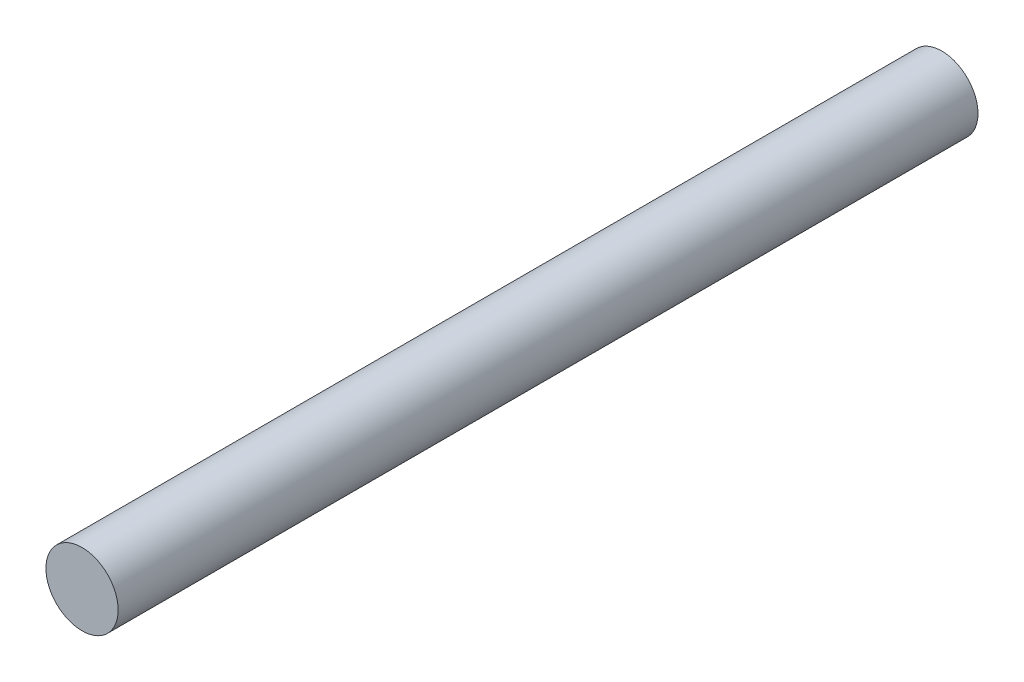
from build123d import *

# Parameters (mm, degrees)
SCHIZZO1_R                   = 2.1
ESTRUSIONE_ESTRUSIONE1_DEPTH = 50


with BuildPart() as part:
    # Schizzo1 → Estrusione-Estrusione1 (new body)
    with BuildSketch(Plane(origin=(0, 0, 0), x_dir=(0, 1, 0), z_dir=(0, 0, 1))):
        with Locations(Location((0, 0, 0), (0, 0, 270))):
            Circle(SCHIZZO1_R)
    extrude(amount=ESTRUSIONE_ESTRUSIONE1_DEPTH)


solid = part.part
